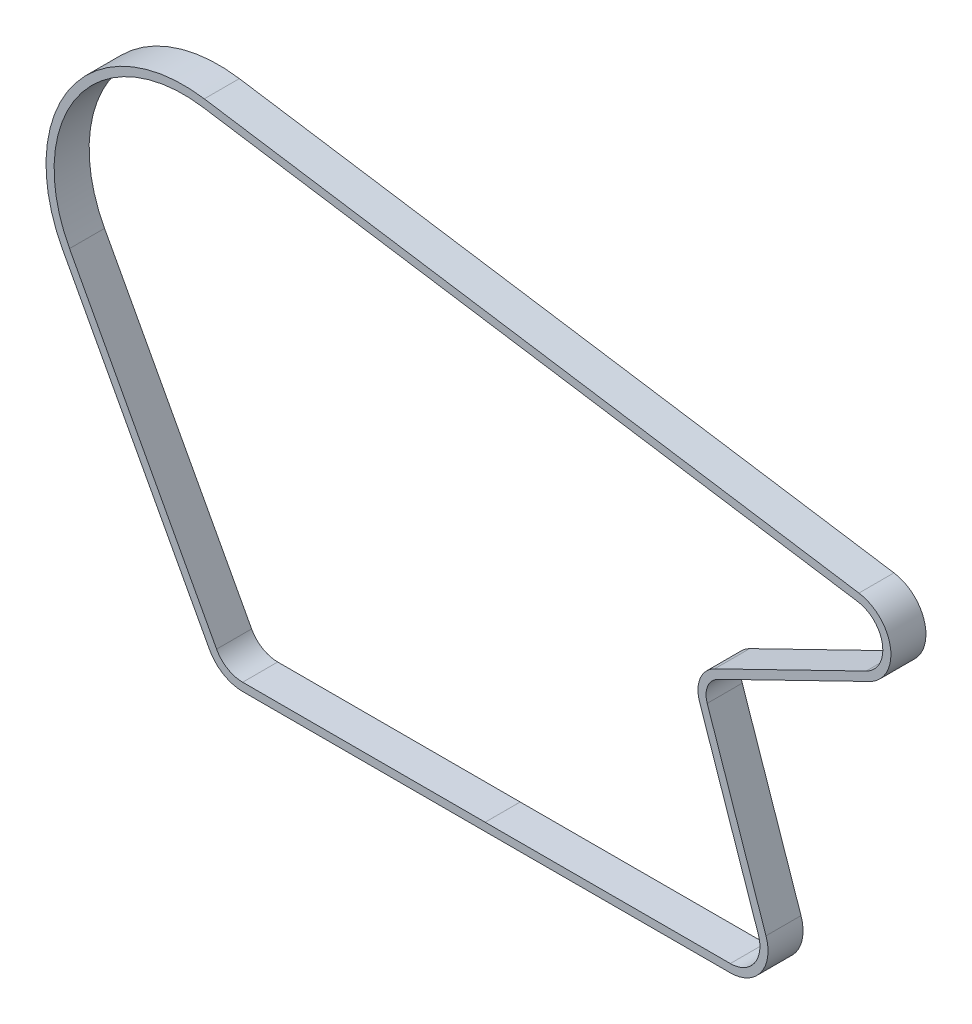
from build123d import *

# Parameters (mm, degrees)
EXTRUDE_THIN1_DEPTH      = 10
EXTRUDE_THIN1_DEPTH_BACK = 3


with BuildPart() as part:
    # Sketch2 → Extrude-Thin1 (new, two sides: drawn at the far end of the back side and taken through both)
    with BuildSketch(Plane.XY.offset(-EXTRUDE_THIN1_DEPTH_BACK)):
        with BuildLine():
            Line((-240.84576429, 51.220485395), (2.128944074, 13.83718169))
            ThreePointArc((2.128944074, 13.83718169), (13.841987462, 2.097470641), (6.132730824, -12.585293506))
            Line((6.132730824, -12.585293506), (-50.115721031, -39.994794473))
            ThreePointArc((-50.115721031, -39.994794473), (-53.998383655, -44.115390019), (-54.18122983, -49.77409517))
            Line((-54.18122983, -49.77409517), (-32.366451516, -113.589833173))
            ThreePointArc((-32.366451516, -113.589833173), (-34.222214173, -126.256574565), (-45.603348876, -132.11831197))
            Line((-45.603348876, -132.11831197), (-136.596329555, -132.186386844))
            ThreePointArc((-136.596329554, -132.186386844), (-136.601566486, -132.186389782), (-136.606803418, -132.186390762))
            Line((-136.606803418, -132.186390762), (-226.602303418, -132.186390762))
            ThreePointArc((-226.602303418, -132.186390762), (-233.783844459, -130.204105531), (-238.931690823, -124.818600515))
            Line((-238.931690823, -124.818600515), (-293.515400395, -23.346583433))
            ThreePointArc((-293.515400395, -23.346583433), (-290.257598601, 30.23714982), (-240.84576429, 51.220485395))
        make_face()
        with BuildLine():
            Line((-241.301966592, 48.255375033), (1.672741773, 10.872071328))
            ThreePointArc((1.672741773, 10.872071328), (10.875847292, 1.648012647), (4.818574219, -9.888444898))
            Line((4.818574219, -9.888444898), (-51.429877637, -37.297945864))
            ThreePointArc((-51.429877637, -37.297945864), (-56.768538744, -42.963764741), (-57.019952235, -50.744484323))
            Line((-57.019952235, -50.744484323), (-35.205173921, -114.560222326))
            ThreePointArc((-35.205173921, -114.560222326), (-36.663273152, -124.512661991), (-45.605593275, -129.11831281))
            Line((-45.605593275, -129.11831281), (-136.598573954, -129.186387684))
            ThreePointArc((-136.598573954, -129.186387684), (-136.602688686, -129.186389992), (-136.606803418, -129.186390762))
            Line((-136.606803418, -129.186390762), (-226.602303418, -129.186390762))
            ThreePointArc((-226.602303418, -129.186390762), (-232.244942807, -127.628880938), (-236.289679236, -123.397412711))
            Line((-236.289679236, -123.397412711), (-290.873388808, -21.925395629))
            ThreePointArc((-290.873388808, -21.925395629), (-287.807222413, 28.506353315), (-241.301966592, 48.255375033))
        make_face(mode=Mode.SUBTRACT)
    extrude(amount=EXTRUDE_THIN1_DEPTH + EXTRUDE_THIN1_DEPTH_BACK)


solid = part.part
